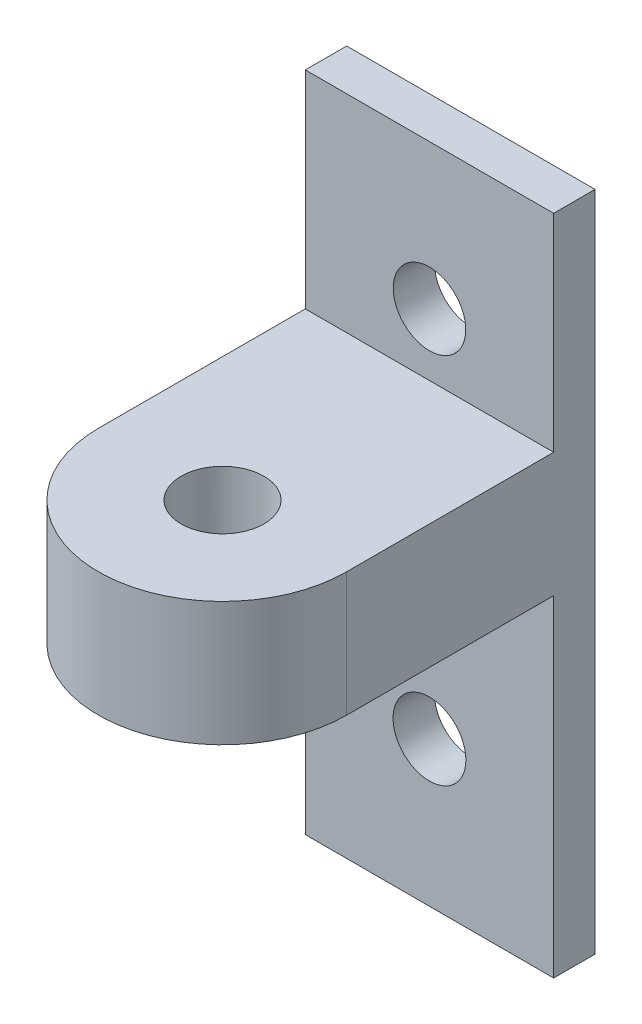
from build123d import *

# Parameters (mm, degrees)
SKETCH1_W           = 38.1
SKETCH1_H           = 101.6
BOSS_EXTRUDE1_DEPTH = 6.35
SKETCH2_R           = 5.5626
SKETCH2_R_2         = 5.588
CUT_EXTRUDE1_DEPTH  = 55.624765446
SKETCH3_W           = 38.1
SKETCH3_H           = 19.05
BOSS_EXTRUDE2_DEPTH = 31.75
BOSS_EXTRUDE3_DEPTH = 19.05
SKETCH5_R           = 6.35
CUT_EXTRUDE2_DEPTH  = 79.801427652


with BuildPart() as part:
    # Sketch1 → Boss-Extrude1 (new body)
    with BuildSketch(Plane.XY):
        Rectangle(SKETCH1_W, SKETCH1_H)
    extrude(amount=BOSS_EXTRUDE1_DEPTH)

    # Sketch2 → Cut-Extrude1 (cut, through all)
    with BuildSketch(Plane.XY.offset(6.35)):
        with Locations((0, 28.575)):
            Circle(SKETCH2_R)
        with Locations((0, -28.575)):
            Circle(SKETCH2_R_2)
    extrude(amount=-CUT_EXTRUDE1_DEPTH, mode=Mode.SUBTRACT)

    # Sketch3 → Boss-Extrude2 (add)
    with BuildSketch(Plane.XY.offset(6.35)):
        with Locations((0, 9.525)):
            Rectangle(SKETCH3_W, SKETCH3_H)
    extrude(amount=BOSS_EXTRUDE2_DEPTH)

    # Sketch4 → Boss-Extrude3 (add)
    with BuildSketch(Plane.XZ):
        with BuildLine():
            Line((19.05, 38.1), (-19.05, 38.1))
            ThreePointArc((-19.05, 38.1), (0, 57.15), (19.05, 38.1))
        make_face()
    extrude(amount=-BOSS_EXTRUDE3_DEPTH)

    # Sketch5 → Cut-Extrude2 (cut, through all)
    with BuildSketch(Plane.XZ):
        with Locations(Location((0, 38.1, 0), (0, 0, 270))):
            Circle(SKETCH5_R)
    extrude(amount=-CUT_EXTRUDE2_DEPTH, mode=Mode.SUBTRACT)


solid = part.part
